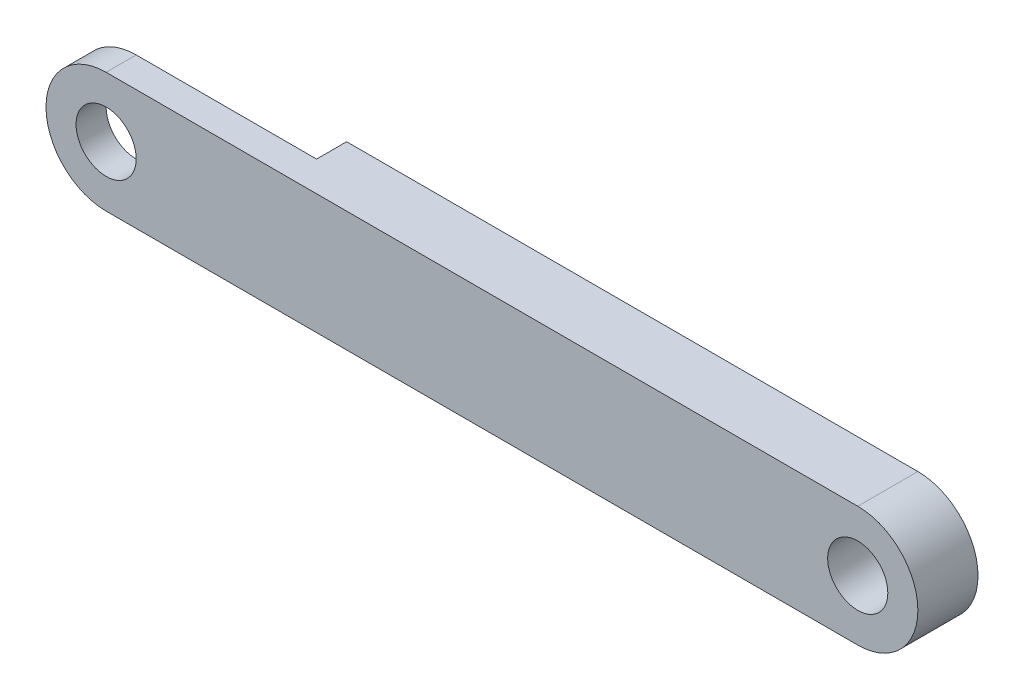
from build123d import *

# Parameters (mm, degrees)
SKETCH1_R           = 5
BOSS_EXTRUDE1_DEPTH = 5
SKETCH2_W           = 59.402785504
SKETCH2_H           = 20
CUT_EXTRUDE1_DEPTH  = 136.462171841


with BuildPart() as part:
    # Sketch1 → Boss-Extrude1 (new, symmetric)
    with BuildSketch(Plane.XY):
        with BuildLine():
            Line((0, 10), (125, 10))
            ThreePointArc((125, 10), (135, 0), (125, -10))
            Line((125, -10), (0, -10))
            ThreePointArc((0, -10), (-10, 0), (0, 10))
        make_face()
        Circle(SKETCH1_R, mode=Mode.SUBTRACT)
        with Locations((125, 0)):
            Circle(SKETCH1_R, mode=Mode.SUBTRACT)
    extrude(amount=BOSS_EXTRUDE1_DEPTH, both=True)

    # Sketch2 → Cut-Extrude1 (cut, through all)
    with BuildSketch(Plane.XY):
        with Locations((0.298607248, 0)):
            Rectangle(SKETCH2_W, SKETCH2_H)
    extrude(amount=-CUT_EXTRUDE1_DEPTH, mode=Mode.SUBTRACT)


solid = part.part
